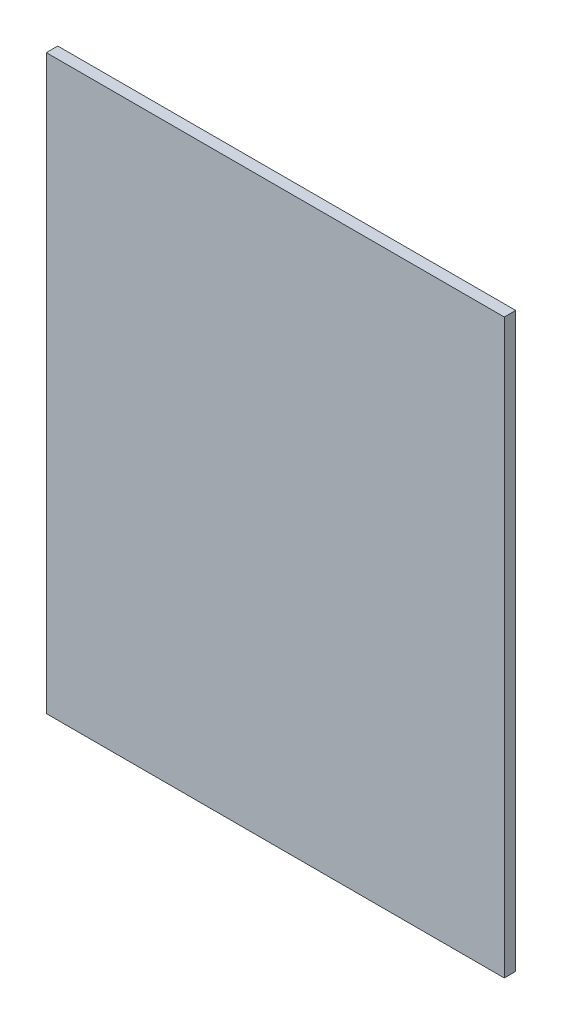
from build123d import *

# Parameters (mm, degrees)
SKETCH_1_W      = 400
SKETCH_1_H      = 500
EXTRUDE_1_DEPTH = 10


with BuildPart() as part:
    # 草图1 → 凸台-拉伸1 (new body)
    with BuildSketch(Plane.XY):
        Rectangle(SKETCH_1_W, SKETCH_1_H)
    extrude(amount=EXTRUDE_1_DEPTH)


solid = part.part
